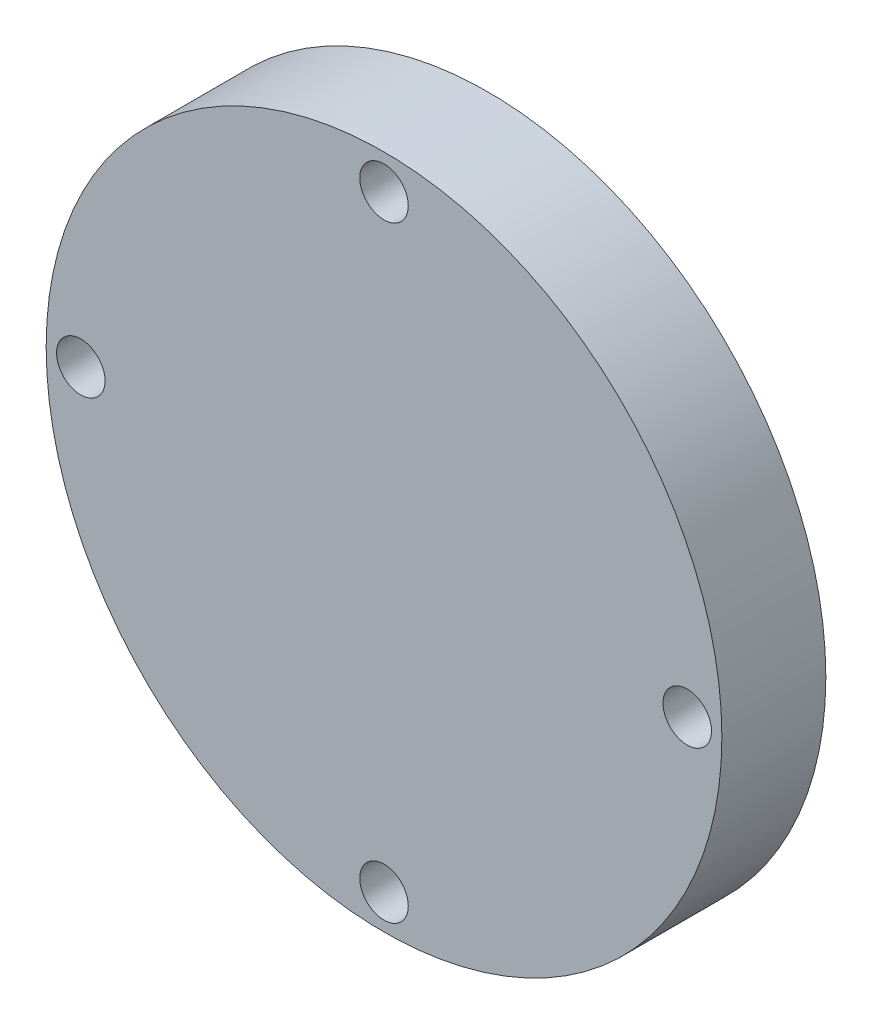
from build123d import *

# Parameters (mm, degrees)
SKETCH1_R           = 19.5
SKETCH1_R_2         = 1.4
BOSS_EXTRUDE1_DEPTH = 6


with BuildPart() as part:
    # Sketch1 → Boss-Extrude1 (new body)
    with BuildSketch(Plane.XY):
        with Locations((8.397290399, 31.494734579)):
            Circle(SKETCH1_R)
        with Locations((8.397290399, 48.994734579)):
            Circle(SKETCH1_R_2, mode=Mode.SUBTRACT)
        with Locations((-9.102709601, 31.494734579)):
            Circle(SKETCH1_R_2, mode=Mode.SUBTRACT)
        with Locations((8.397290399, 13.994734579)):
            Circle(SKETCH1_R_2, mode=Mode.SUBTRACT)
        with Locations((25.897290399, 31.494734579)):
            Circle(SKETCH1_R_2, mode=Mode.SUBTRACT)
    extrude(amount=BOSS_EXTRUDE1_DEPTH)


solid = part.part
